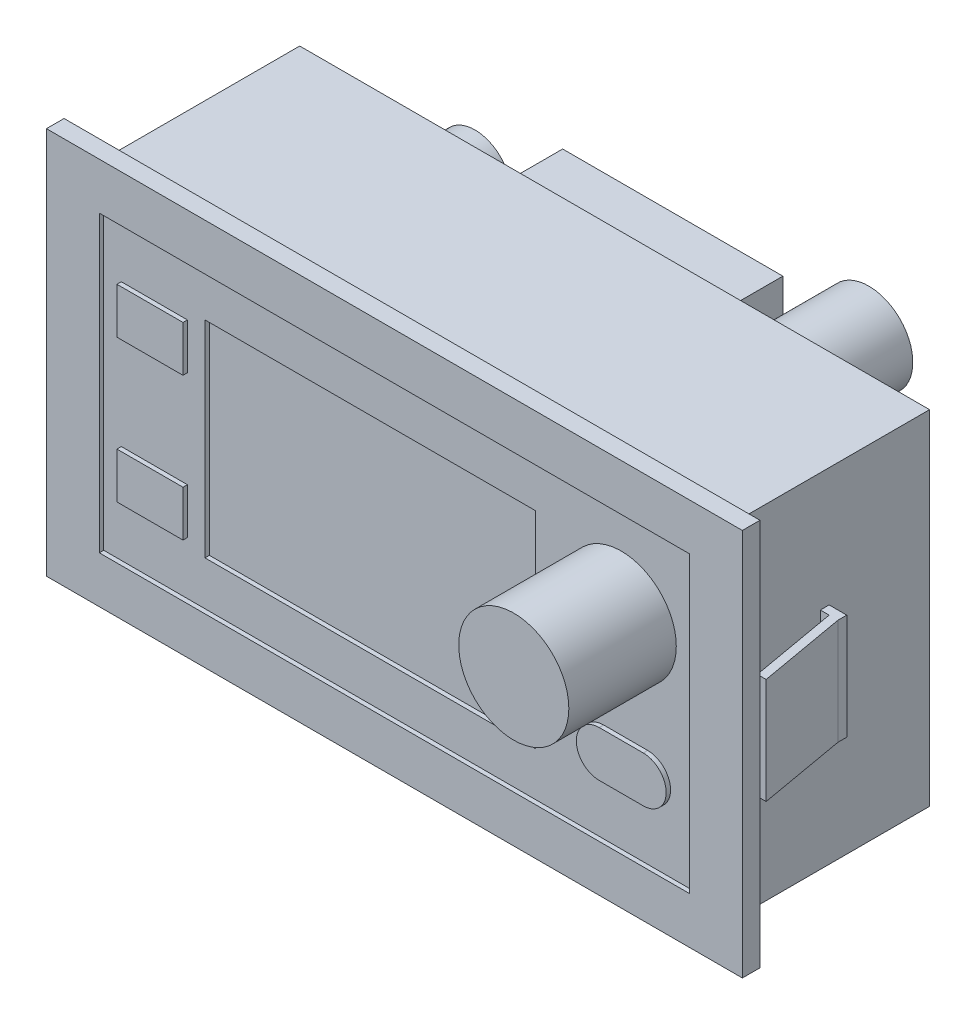
from build123d import *

# Parameters (mm, degrees)
SKETCH_1_R          = 6.25
EXTRUDE_1_DEPTH     = 12.2
EXTRUDE_START       = -12.2
SKETCH_1_3_W        = 79
SKETCH_1_3_H        = 44
SKETCH_1_3_W_2      = 67
SKETCH_1_3_H_2      = 33.4
EXTRUDE_2_DEPTH     = 2
EXTRUDE_START_2     = -14.2
SKETCH_1_4_W        = 67
SKETCH_1_4_H        = 33.4
EXTRUDE_3_DEPTH     = 1.5
EXTRUDE_START_3     = -12.7
SKETCH_1_5_W        = 7.5
SKETCH_1_5_H        = 5.2
EXTRUDE_4_DEPTH     = 0.5
EXTRUDE_4_2_DEPTH   = 0.5
EXTRUDE_4_3_DEPTH   = 0.5
SKETCH_2_W          = 71.5
SKETCH_2_H          = 39
EXTRUDE_5_DEPTH     = 23
CUT_EXTRUDE_START   = -12.7
SKETCH_1_7_W        = 37.5
SKETCH_1_7_H        = 23.4
CUT_EXTRUDE_3_DEPTH = 0.5
EXTRUDE_START_4     = -13.5
EXTRUDE_6_DEPTH     = 12
CUT_EXTRUDE_4_DEPTH = 10
SKETCH_4_3_W        = 21
SKETCH_4_3_H        = 12
EXTRUDE_7_DEPTH     = 8
EXTRUDE_START_5     = -12
SKETCH_7_W          = 24
SKETCH_7_H          = 20
EXTRUDE_8_DEPTH     = 2
CUT_EXTRUDE_5_DEPTH = 6.2
SKETCH_9_W          = 25
SKETCH_9_H          = 25
EXTRUDE_9_DEPTH     = 12.8
SKETCH_9_3_R        = 4.1
EXTRUDE_10_DEPTH    = 13.2
SKETCH_9_5_R        = 5
EXTRUDE_12_DEPTH    = 16.9
SKETCH_9_6_R        = 4.1
EXTRUDE_13_DEPTH    = 16.5
SKETCH_9_7_W        = 20
SKETCH_9_7_H        = 8.8
EXTRUDE_14_DEPTH    = 18.3


with BuildPart() as part:
    # 草图1 → 凸台-拉伸1 (new body)
    with BuildSketch(Plane.XY):
        with Locations((65.25, -15.15)):
            Circle(SKETCH_1_R)
    extrude(amount=-EXTRUDE_1_DEPTH)


with BuildPart() as body_2:
    # 草图1<3> → 凸台-拉伸2 (new body)
    with BuildSketch(Plane.XY.offset(EXTRUDE_START)):
        with Locations((39.5, -22)):
            Rectangle(SKETCH_1_3_W, SKETCH_1_3_H)
        with Locations((39.5, -22)):
            Rectangle(SKETCH_1_3_W_2, SKETCH_1_3_H_2, mode=Mode.SUBTRACT)
    extrude(amount=-EXTRUDE_2_DEPTH)

    # 草图1<4> → 凸台-拉伸3 (add)
    with BuildSketch(Plane.XY.offset(EXTRUDE_START_2)):
        with Locations((39.5, -22)):
            Rectangle(SKETCH_1_4_W, SKETCH_1_4_H)
    extrude(amount=EXTRUDE_3_DEPTH)

    # 草图2 → 凸台-拉伸5 (add)
    with BuildSketch(Plane(origin=(0, 0, -14.2), x_dir=(-1, 0, 0), z_dir=(0, 0, -1))):
        with Locations((-39.5, -22)):
            Rectangle(SKETCH_2_W, SKETCH_2_H)
    extrude(amount=EXTRUDE_5_DEPTH)

    # 草图1<7> → 切除-拉伸3 (cut)
    with BuildSketch(Plane.XY.offset(CUT_EXTRUDE_START)):
        with Locations((36.25, -22)):
            Rectangle(SKETCH_1_7_W, SKETCH_1_7_H)
    extrude(amount=-CUT_EXTRUDE_3_DEPTH, mode=Mode.SUBTRACT)

    # 草图3 → 凸台-拉伸6 (add)
    with BuildSketch(Plane.XZ.offset(41.5).offset(EXTRUDE_START_4)):
        Polygon((1.75, -24.8), (1.75, -25.8), (3.75, -25.8), (3.75, -24.8), (2.75, -24.8), (1, -14.9), (0, -14.9), align=None)
        Polygon((75.25, -24.8), (75.25, -25.8), (77.25, -25.8), (77.25, -24.8), (79, -14.9), (78, -14.9), (76.25, -24.8), align=None)
    extrude(amount=-EXTRUDE_6_DEPTH)

    # 草图4 → 切除-拉伸4 (cut)
    with BuildSketch(Plane.XZ.offset(41.5)):
        with BuildLine():
            Line((50, -22.2), (29, -22.2))
            ThreePointArc((29, -22.2), (27.939339828, -22.639339828), (27.5, -23.7))
            Line((27.5, -23.7), (27.5, -37.2))
            Line((27.5, -37.2), (51.5, -37.2))
            Line((51.5, -37.2), (51.5, -23.7))
            ThreePointArc((51.5, -23.7), (51.060660172, -22.639339828), (50, -22.2))
        make_face()
    extrude(amount=-CUT_EXTRUDE_4_DEPTH, mode=Mode.SUBTRACT)



with BuildPart() as body_3:
    # 草图1<5> → 凸台-拉伸4 (new body)
    with BuildSketch(Plane.XY.offset(EXTRUDE_START_3)):
        with Locations((11.75, -13.9)):
            Rectangle(SKETCH_1_5_W, SKETCH_1_5_H)
    extrude(amount=EXTRUDE_4_DEPTH)


with BuildPart() as body_4:
    # 草图1<5> → Extrude 4 2 (new body)
    with BuildSketch(Plane.XY.offset(EXTRUDE_START_3)):
        with Locations((11.75, -30.1)):
            Rectangle(SKETCH_1_5_W, SKETCH_1_5_H)
    extrude(amount=EXTRUDE_4_2_DEPTH)


with BuildPart() as body_5:
    # 草图1<5> → Extrude 4 3 (new body)
    with BuildSketch(Plane.XY.offset(EXTRUDE_START_3)):
        with BuildLine():
            Line((62.75, -27.5), (67.75, -27.5))
            ThreePointArc((67.75, -27.5), (70.35, -30.1), (67.75, -32.7))
            Line((67.75, -32.7), (62.75, -32.7))
            ThreePointArc((62.75, -32.7), (60.15, -30.1), (62.75, -27.5))
        make_face()
    extrude(amount=EXTRUDE_4_3_DEPTH)


with BuildPart() as body_6:
    # 草图4<3> → 凸台-拉伸7 (new body)
    with BuildSketch(Plane.XZ.offset(41.5)):
        with Locations((39.5, -35)):
            Rectangle(SKETCH_4_3_W, SKETCH_4_3_H)
    extrude(amount=-EXTRUDE_7_DEPTH)


with BuildPart() as body_2_1:
    add(body_2.part)

    add(body_6.part)  # 凸台-拉伸8 merges body 6
    # 草图7 → 凸台-拉伸8 (add)
    with BuildSketch(Plane(origin=(0, 0, -41), x_dir=(-1, 0, 0), z_dir=(0, 0, -1)).offset(EXTRUDE_START_5)):
        with Locations((-39.5, -31.5)):
            Rectangle(SKETCH_7_W, SKETCH_7_H)
    extrude(amount=EXTRUDE_8_DEPTH)

    # 草图8 → 切除-拉伸5 (cut)
    with BuildSketch(Plane(origin=(0, 0, -37.2), x_dir=(-1, 0, 0), z_dir=(0, 0, -1))):
        Polygon((-4.95, -3.7), (-74.05, -3.7), (-74.05, -40.3), (-51.5, -40.3), (-51.5, -31.5), (-27.5, -31.5), (-27.5, -40.3), (-4.95, -40.3), align=None)
    extrude(amount=-CUT_EXTRUDE_5_DEPTH, mode=Mode.SUBTRACT)

    # 草图9 → 凸台-拉伸9 (add)
    with BuildSketch(Plane(origin=(0, 0, -31), x_dir=(-1, 0, 0), z_dir=(0, 0, -1))):
        with Locations((-39.5, -16.8)):
            Rectangle(SKETCH_9_W, SKETCH_9_H)
    extrude(amount=EXTRUDE_9_DEPTH)

    # 草图9<3> → 凸台-拉伸10 (add)
    with BuildSketch(Plane(origin=(0, 0, -31), x_dir=(-1, 0, 0), z_dir=(0, 0, -1))):
        with Locations((-16.65, -11.9)):
            Circle(SKETCH_9_3_R)
    extrude(amount=EXTRUDE_10_DEPTH)

    # 草图9<5> → 凸台-拉伸12 (add)
    with BuildSketch(Plane(origin=(0, 0, -31), x_dir=(-1, 0, 0), z_dir=(0, 0, -1))):
        with Locations((-57.65, -9.5)):
            Circle(SKETCH_9_5_R)
        with Locations((-15.75, -33.5)):
            Circle(SKETCH_9_5_R)
    extrude(amount=EXTRUDE_12_DEPTH)

    # 草图9<6> → 凸台-拉伸13 (add)
    with BuildSketch(Plane(origin=(0, 0, -31), x_dir=(-1, 0, 0), z_dir=(0, 0, -1))):
        with Locations((-60.85, -35.2)):
            Circle(SKETCH_9_6_R)
    extrude(amount=EXTRUDE_13_DEPTH)

    # 草图9<7> → 凸台-拉伸14 (add)
    with BuildSketch(Plane(origin=(0, 0, -31), x_dir=(-1, 0, 0), z_dir=(0, 0, -1))):
        with Locations((-15.25, -22.6)):
            Rectangle(SKETCH_9_7_W, SKETCH_9_7_H)
    extrude(amount=EXTRUDE_14_DEPTH)


solid = Compound([part.part, body_3.part, body_4.part, body_5.part, body_2_1.part])
